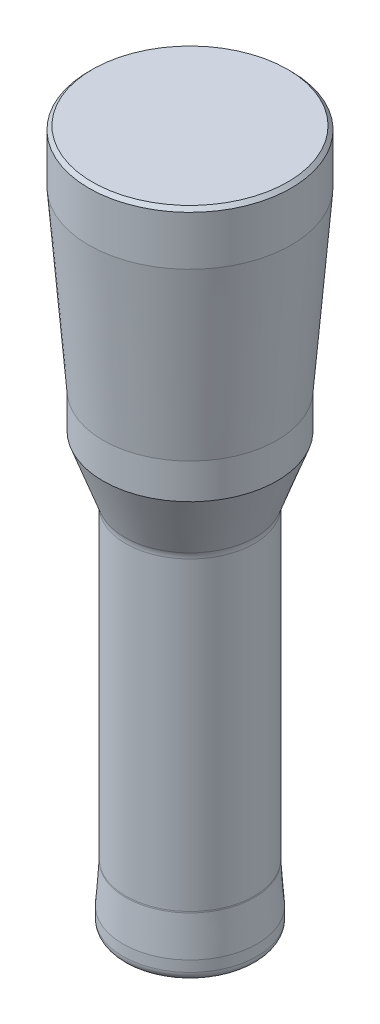
from build123d import *

# Parameters (mm, degrees)
SFAZOWANIE1_SIZE = 1


with BuildPart() as part:
    # Szkic1 → Obrót5 (revolve)
    with BuildSketch(Plane.XY, mode=Mode.PRIVATE) as obr_t5_sk:
        with BuildLine():
            Line((-18.236763899, 104.399774637), (-18.236763899, 17.739774637))
            ThreePointArc((-18.236763899, 17.739774637), (-18.239809764, 17.565277154), (-18.248943647, 17.390992269))
            Line((-18.248943647, 17.390992269), (-19.02, 6.364372704))
            Line((-19.02, 6.364372704), (-19.02, 3.307537954))
            ThreePointArc((-19.02, 3.307537954), (-18.362673282, 1.561062759), (-16.716937778, 0.681398805))
            Line((-16.716937778, 0.681398805), (-11.5412, 0))
            Line((-11.5412, 0), (0, 0))
            Line((0, 0), (0, 198.039004786))
            Line((0, 198.039004786), (-28.72, 198.039004786))
            Line((-28.72, 198.039004786), (-28.72, 183.039004786))
            Line((-28.72, 183.039004786), (-24.7, 133.039004786))
            Line((-24.7, 133.039004786), (-24.7, 123.039004786))
            Line((-24.7, 123.039004786), (-18.538300795, 106.109875354))
            ThreePointArc((-18.538300795, 106.109875354), (-18.312725134, 105.268015526), (-18.236763899, 104.399774637))
        make_face()
    revolve(obr_t5_sk.sketch.rotate(Axis((0, 198.039004786, 0), (0, -1, 0)), 270), axis=Axis((0, 198.039004786, 0), (0, -1, 0)))

    # Sfazowanie1
    sfazowanie1_edges = [part.edges().sort_by_distance(p)[0] for p in [
        (0, 198.039004786, -28.72),
    ]]
    chamfer(sfazowanie1_edges, length=SFAZOWANIE1_SIZE)


solid = part.part
